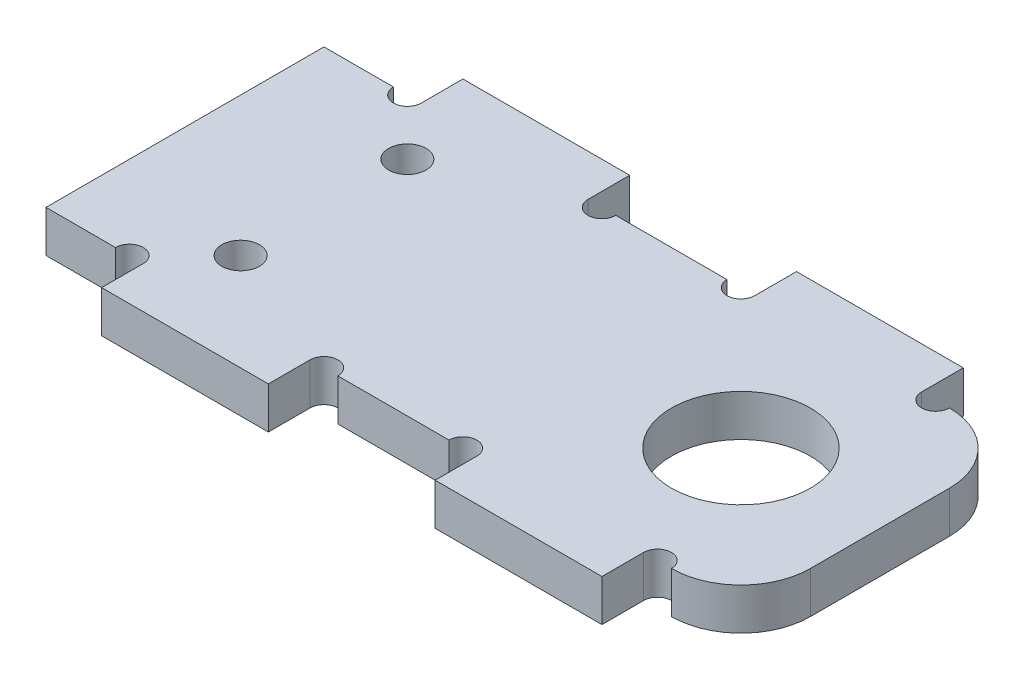
from build123d import *

# Parameters (mm, degrees)
SKETCH_1_R          = 5
SKETCH_1_R_2        = 1.35
EXTRUDE_1_DEPTH     = 3
FILLET_1_R          = 5
SKETCH_3_W          = 12
SKETCH_3_H          = 3
EXTRUDE_2_DEPTH     = 3
SKETCH_4_R          = 1
CUT_EXTRUDE_1_DEPTH = 43.166337285


with BuildPart() as part:
    # 草图1 → 凸台-拉伸1 (new body)
    with BuildSketch(Plane(origin=(0, 0, 0), x_dir=(1, 0, 0), z_dir=(0, 1, 0))):
        Polygon((-10, -10), (10, -10), (10, 10), (-10, 10), (-30, 10), (-40, 10), (-40, -10), (-30, -10), align=None)
        with Locations(Location((0, 0, 0), (0, 0, 270))):
            Circle(SKETCH_1_R, mode=Mode.SUBTRACT)
        with Locations(Location((-30, -6, 0), (0, 0, 270))):
            Circle(SKETCH_1_R_2, mode=Mode.SUBTRACT)
        with Locations(Location((-30, 6, 0), (0, 0, 90))):
            Circle(SKETCH_1_R_2, mode=Mode.SUBTRACT)
    extrude(amount=EXTRUDE_1_DEPTH)

    # 圆角1
    fillet_1_edges = [part.edges().sort_by_distance(p)[0] for p in [
        (10, 1.5, 10),
        (10, 1.5, -10),
    ]]
    fillet(fillet_1_edges, radius=FILLET_1_R)

    # 草图3 → 凸台-拉伸2 (add)
    with BuildSketch(Plane.XZ):
        with Locations((-3, 11.5)):
            Rectangle(SKETCH_3_W, SKETCH_3_H)
        with Locations((-27, 11.5)):
            Rectangle(SKETCH_3_W, SKETCH_3_H)
        with Locations((-3, -11.5)):
            Rectangle(SKETCH_3_W, SKETCH_3_H)
        with Locations((-27, -11.5)):
            Rectangle(SKETCH_3_W, SKETCH_3_H)
    extrude(amount=-EXTRUDE_2_DEPTH)

    # 草图4 → 切除-拉伸1 (cut, through all)
    with BuildSketch(Plane.XZ):
        with Locations((-34, 10)):
            Circle(SKETCH_4_R)
        with Locations((-20, 10)):
            Circle(SKETCH_4_R)
        with Locations((-10, 10)):
            Circle(SKETCH_4_R)
        with Locations((4, 10)):
            Circle(SKETCH_4_R)
        with Locations((4, -10)):
            Circle(SKETCH_4_R)
        with Locations((-10, -10)):
            Circle(SKETCH_4_R)
        with Locations((-20, -10)):
            Circle(SKETCH_4_R)
        with Locations((-34, -10)):
            Circle(SKETCH_4_R)
    extrude(amount=-CUT_EXTRUDE_1_DEPTH, mode=Mode.SUBTRACT)


solid = part.part
